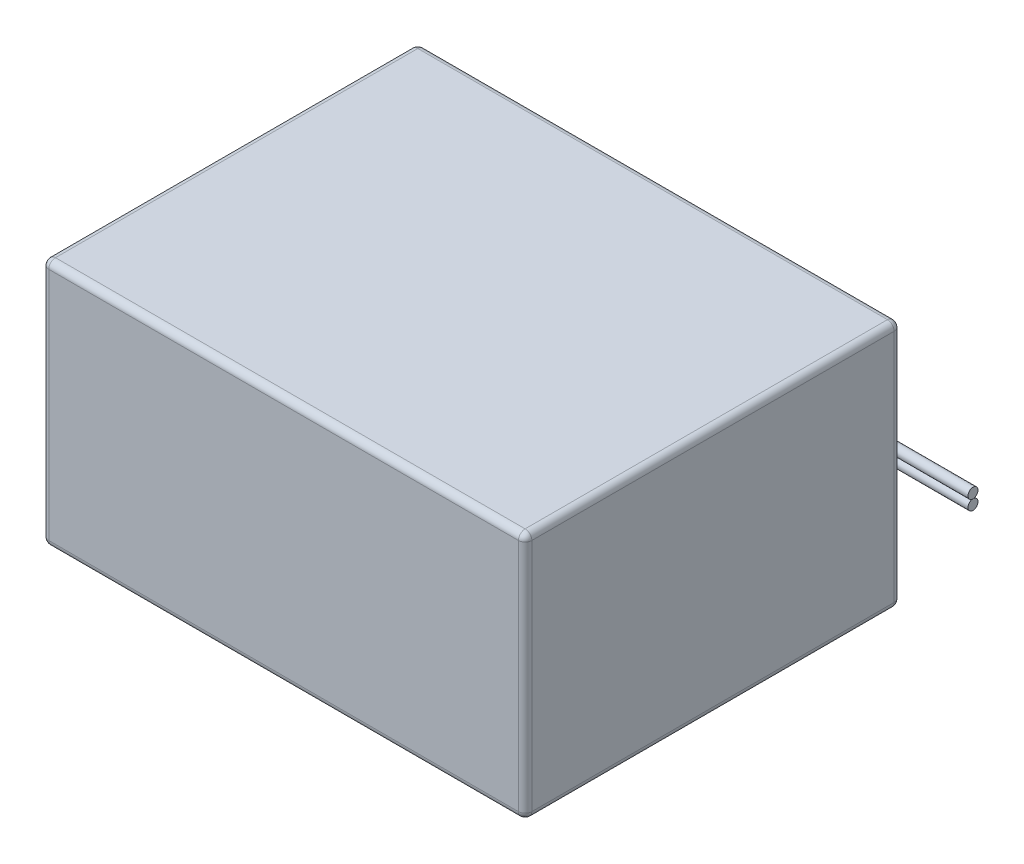
from build123d import *

# Parameters (mm, degrees)
SKETCH1_W                  = 72
SKETCH1_H                  = 56
BOSS_EXTRUDE1_DEPTH        = 37
BOSS_EXTRUDE2_DEPTH        = 10
BOSS_EXTRUDE2_DEPTH_BACK   = 5
BOSS_EXTRUDE2_START        = 36
SKETCH2_R                  = 0.75
BOSS_EXTRUDE2_2_DEPTH      = 10
BOSS_EXTRUDE2_2_DEPTH_BACK = 5
BOSS_EXTRUDE2_2_START      = 36
FILLET1_R                  = 1


with BuildPart() as part:
    # Sketch1 → Boss-Extrude1 (new body)
    with BuildSketch(Plane(origin=(0, 0, 0), x_dir=(1, 0, 0), z_dir=(0, 1, 0))):
        Rectangle(SKETCH1_W, SKETCH1_H)
    extrude(amount=BOSS_EXTRUDE1_DEPTH)

    # Fillet1
    fillet1_edges = [part.edges().sort_by_distance(p)[0] for p in [
        (-36, 37, 0),
        (0, 37, 28),
        (36, 37, 0),
        (0, 0, 28),
        (-36, 0, 0),
        (0, 0, -28),
        (36, 0, 0),
        (36, 18.5, 28),
        (-36, 18.5, 28),
        (-36, 18.5, -28),
        (36, 18.5, -28),
        (0, 37, -28),
    ]]
    fillet(fillet1_edges, radius=FILLET1_R)


with BuildPart() as body_2:
    # Sketch2 → Boss-Extrude2 (new, two sides: drawn at the far end of the back side and taken through both)
    with BuildSketch(Plane(origin=(0, 0, 0), x_dir=(0, 0, -1), z_dir=(1, 0, 0)).offset(BOSS_EXTRUDE2_START - BOSS_EXTRUDE2_DEPTH_BACK)):
        with Locations(Location((28.75, 19.25, 0), (0, 0, 180))):
            Circle(SKETCH2_R)
    extrude(amount=BOSS_EXTRUDE2_DEPTH + BOSS_EXTRUDE2_DEPTH_BACK)


with BuildPart() as body_3:
    # Sketch2 → Boss-Extrude2 2 (new, two sides: drawn at the far end of the back side and taken through both)
    with BuildSketch(Plane(origin=(0, 0, 0), x_dir=(0, 0, -1), z_dir=(1, 0, 0)).offset(BOSS_EXTRUDE2_2_START - BOSS_EXTRUDE2_2_DEPTH_BACK)):
        with Locations(Location((28.75, 17.75, 0), (0, 0, 180))):
            Circle(SKETCH2_R)
    extrude(amount=BOSS_EXTRUDE2_2_DEPTH + BOSS_EXTRUDE2_2_DEPTH_BACK)


solid = Compound([part.part, body_2.part, body_3.part])
